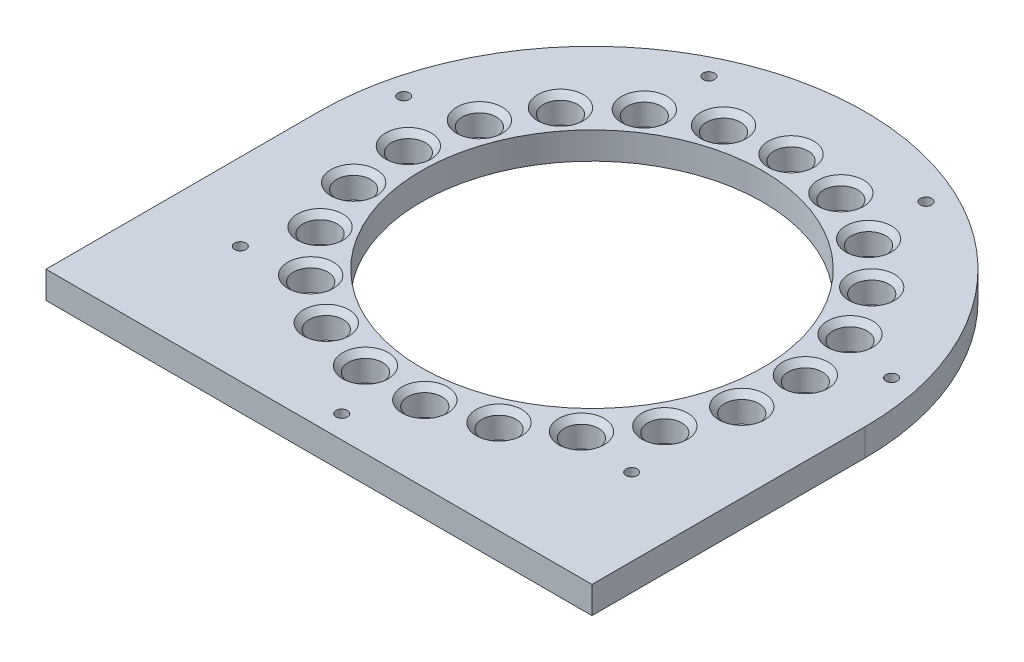
from build123d import *

# Parameters (mm, degrees)
SKETCH17_W          = 96
SKETCH17_H          = 48
BOSS_EXTRUDE1_DEPTH = 4.7625
SKETCH2_R           = 48
SKETCH2_R_2         = 3
SKETCH2_R_3         = 1
SKETCH2_R_4         = 30
BOSS_EXTRUDE2_DEPTH = 4.7625
SKETCH2_11_R        = 3
SKETCH2_11_R_2      = 1
SKETCH2_11_R_3      = 30
CUT_EXTRUDE1_DEPTH  = 4.7625
CHAMFER1_SIZE       = 1


with BuildPart() as part:
    # Sketch17 → Boss-Extrude1 (new body)
    with BuildSketch(Plane(origin=(0, 0, 0), x_dir=(1, 0, 0), z_dir=(0, 1, 0))):
        with Locations((0, -24)):
            Rectangle(SKETCH17_W, SKETCH17_H)
    extrude(amount=BOSS_EXTRUDE1_DEPTH)

    # Sketch2 → Boss-Extrude2 (add)
    with BuildSketch(Plane(origin=(0, 0, 0), x_dir=(1, 0, 0), z_dir=(0, 1, 0))):
        Circle(SKETCH2_R)
        with Locations((0, 35)):
            Circle(SKETCH2_R_2, mode=Mode.SUBTRACT)
        with Locations((10.316431104, 33.445048203)):
            Circle(SKETCH2_R_2, mode=Mode.SUBTRACT)
        with Locations((19.716202032, 28.918357101)):
            Circle(SKETCH2_R_2, mode=Mode.SUBTRACT)
        with Locations((27.364101886, 21.822143065)):
            Circle(SKETCH2_R_2, mode=Mode.SUBTRACT)
        with Locations((32.580581203, 12.786935853)):
            Circle(SKETCH2_R_2, mode=Mode.SUBTRACT)
        with Locations((34.902132901, 2.615553276)):
            Circle(SKETCH2_R_2, mode=Mode.SUBTRACT)
        with Locations((34.122476926, -7.788232688)):
            Circle(SKETCH2_R_2, mode=Mode.SUBTRACT)
        with Locations((30.310889132, -17.5)):
            Circle(SKETCH2_R_2, mode=Mode.SUBTRACT)
        with Locations((23.806045822, -25.656815514)):
            Circle(SKETCH2_R_2, mode=Mode.SUBTRACT)
        with Locations((15.185930869, -31.533910377)):
            Circle(SKETCH2_R_2, mode=Mode.SUBTRACT)
        with Locations((5.216479316, -34.609078918)):
            Circle(SKETCH2_R_2, mode=Mode.SUBTRACT)
        with Locations((-5.216479316, -34.609078918)):
            Circle(SKETCH2_R_2, mode=Mode.SUBTRACT)
        with Locations((-15.185930869, -31.533910377)):
            Circle(SKETCH2_R_2, mode=Mode.SUBTRACT)
        with Locations((-23.806045822, -25.656815514)):
            Circle(SKETCH2_R_2, mode=Mode.SUBTRACT)
        with Locations((-30.310889132, -17.5)):
            Circle(SKETCH2_R_2, mode=Mode.SUBTRACT)
        with Locations((-34.122476926, -7.788232688)):
            Circle(SKETCH2_R_2, mode=Mode.SUBTRACT)
        with Locations((0, -44)):
            Circle(SKETCH2_R_3, mode=Mode.SUBTRACT)
        with Locations((-34.400585229, -27.433551282)):
            Circle(SKETCH2_R_3, mode=Mode.SUBTRACT)
        with Locations((-42.896828136, 9.790921094)):
            Circle(SKETCH2_R_3, mode=Mode.SUBTRACT)
        with Locations((-19.090884521, 39.642630188)):
            Circle(SKETCH2_R_3, mode=Mode.SUBTRACT)
        with Locations((19.090884521, 39.642630188)):
            Circle(SKETCH2_R_3, mode=Mode.SUBTRACT)
        with Locations((42.896828136, 9.790921094)):
            Circle(SKETCH2_R_3, mode=Mode.SUBTRACT)
        with Locations((34.400585229, -27.433551282)):
            Circle(SKETCH2_R_3, mode=Mode.SUBTRACT)
        with Locations((-34.902132901, 2.615553276)):
            Circle(SKETCH2_R_2, mode=Mode.SUBTRACT)
        with Locations((-32.580581203, 12.786935853)):
            Circle(SKETCH2_R_2, mode=Mode.SUBTRACT)
        with Locations((-27.364101886, 21.822143065)):
            Circle(SKETCH2_R_2, mode=Mode.SUBTRACT)
        with Locations((-19.716202032, 28.918357101)):
            Circle(SKETCH2_R_2, mode=Mode.SUBTRACT)
        with Locations((-10.316431104, 33.445048203)):
            Circle(SKETCH2_R_2, mode=Mode.SUBTRACT)
        Circle(SKETCH2_R_4, mode=Mode.SUBTRACT)
    extrude(amount=BOSS_EXTRUDE2_DEPTH)

    # Sketch2<11> → Cut-Extrude1 (cut)
    with BuildSketch(Plane(origin=(0, 0, 0), x_dir=(1, 0, 0), z_dir=(0, 1, 0))):
        with Locations((34.902132901, 2.615553276)):
            Circle(SKETCH2_11_R)
        with Locations((34.122476926, -7.788232688)):
            Circle(SKETCH2_11_R)
        with Locations((30.310889132, -17.5)):
            Circle(SKETCH2_11_R)
        with Locations((23.806045822, -25.656815514)):
            Circle(SKETCH2_11_R)
        with Locations((15.185930869, -31.533910377)):
            Circle(SKETCH2_11_R)
        with Locations((5.216479316, -34.609078918)):
            Circle(SKETCH2_11_R)
        with Locations((-5.216479316, -34.609078918)):
            Circle(SKETCH2_11_R)
        with Locations((-15.185930869, -31.533910377)):
            Circle(SKETCH2_11_R)
        with Locations((-23.806045822, -25.656815514)):
            Circle(SKETCH2_11_R)
        with Locations((-30.310889132, -17.5)):
            Circle(SKETCH2_11_R)
        with Locations((-34.122476926, -7.788232688)):
            Circle(SKETCH2_11_R)
        with Locations((0, -44)):
            Circle(SKETCH2_11_R_2)
        with Locations((-34.400585229, -27.433551282)):
            Circle(SKETCH2_11_R_2)
        with Locations((34.400585229, -27.433551282)):
            Circle(SKETCH2_11_R_2)
        with Locations((-34.902132901, 2.615553276)):
            Circle(SKETCH2_11_R)
        Circle(SKETCH2_11_R_3)
    extrude(amount=CUT_EXTRUDE1_DEPTH, mode=Mode.SUBTRACT)

    # Chamfer1
    chamfer1_edges = [part.edges().sort_by_distance(p)[0] for p in [
        (-8.216479316, 4.7625, 34.609078918),
        (-18.185930869, 4.7625, 31.533910377),
        (-26.806045822, 4.7625, 25.656815514),
        (-33.310889132, 4.7625, 17.5),
        (-37.122476926, 4.7625, 7.788232688),
        (-33.432819775, 4.7625, -5.231106551),
        (-35.580581203, 4.7625, -12.786935853),
        (-30.364101886, 4.7625, -21.822143065),
        (-22.716202032, 4.7625, -28.918357101),
        (-13.316431104, 4.7625, -33.445048203),
        (-3, 4.7625, -35),
        (7.316431104, 4.7625, -33.445048203),
        (16.716202032, 4.7625, -28.918357101),
        (24.364101886, 4.7625, -21.822143065),
        (29.580581203, 4.7625, -12.786935853),
        (36.371446028, 4.7625, -5.231106551),
        (31.122476926, 4.7625, 7.788232688),
        (27.310889132, 4.7625, 17.5),
        (20.806045822, 4.7625, 25.656815514),
        (12.185930869, 4.7625, 31.533910377),
        (2.216479316, 4.7625, 34.609078918),
    ]]
    chamfer(chamfer1_edges, length=CHAMFER1_SIZE)


solid = part.part
